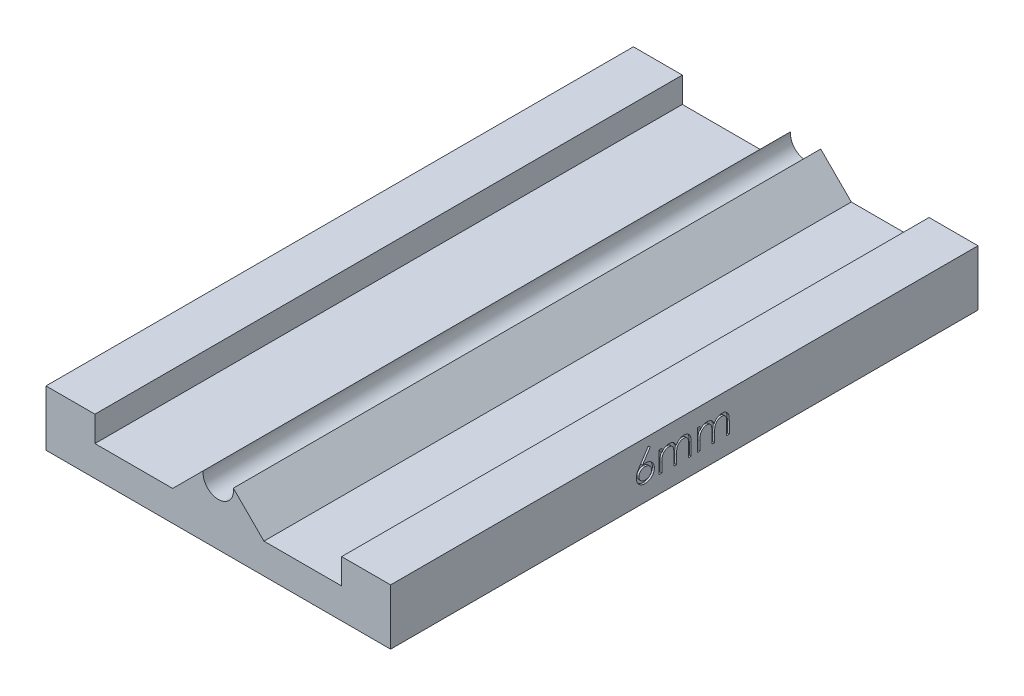
from build123d import *

# Parameters (mm, degrees)
BOSS_EXTRUDE1_DEPTH = 120
CUT_EXTRUDE1_DEPTH  = 0.4


with BuildPart() as part:
    # Sketch1 → Boss-Extrude1 (new body)
    with BuildSketch(Plane.XY):
        with BuildLine():
            ThreePointArc((3.1, 0), (-0.218115239, -3.092317212), (-3.069306931, 0.43514936))
            Line((-3.069306931, 0.43514936), (-9.320394247, -5.815937957))
            Line((-9.320394247, -5.815937957), (-25.2, -5.815937957))
            Line((-25.2, -5.815937957), (-25.2, -0.615937957))
            Line((-25.2, -0.615937957), (-35.2, -0.615937957))
            Line((-35.2, -0.615937957), (-35.2, -12))
            Line((-35.2, -12), (35.2, -12))
            Line((35.2, -12), (35.2, -0.615937957))
            Line((35.2, -0.615937957), (25.2, -0.615937957))
            Line((25.2, -0.615937957), (25.2, -5.815937957))
            Line((25.2, -5.815937957), (9.320394247, -5.815937957))
            Line((9.320394247, -5.815937957), (3.069306931, 0.43514936))
            ThreePointArc((3.069306931, 0.43514936), (3.092317212, 0.218115239), (3.1, 0))
        make_face()
    extrude(amount=BOSS_EXTRUDE1_DEPTH)

    # Sketch2 → Cut-Extrude1 (cut)
    # profile 1 of 3: a face of its own
    with BuildSketch(Plane(origin=(35.2, 0, 0), x_dir=(0, 0, -1), z_dir=(1, 0, 0))):
        with BuildLine():
            Line((-67.354397823, -2.389751919), (-66.938532439, -2.715473073))
            Line((-66.938532439, -2.715473073), (-68.523868977, -5.139751919))
            add(Edge.make_bspline(
                [(-68.523868977, -5.139751919), (-68.418319931, -5.122928158), (-68.212434582, -5.09011151), (-68.004035899, -5.084697889), (-67.902474747, -5.082059612)],
                knots=[0, 0, 0, 0, 1.025318673, 2, 2, 2, 2], degree=3))
            add(Edge.make_bspline(
                [(-67.902474747, -5.082059612), (-67.841490255, -5.083674921), (-67.721841154, -5.086844094), (-67.546033554, -5.111889088), (-67.37706088, -5.150871482), (-67.215300087, -5.207924586), (-67.060545879, -5.280781784), (-66.911913343, -5.368106642), (-66.772195572, -5.474401797), (-66.639593561, -5.593141804), (-66.519204249, -5.724656612), (-66.412616726, -5.864201766), (-66.323085082, -6.011631847), (-66.250444074, -6.166872189), (-66.194035711, -6.329683491), (-66.152914033, -6.499857444), (-66.12860616, -6.677511395), (-66.125305319, -6.798331124), (-66.123628593, -6.859703842)],
                knots=[0, 0, 0, 0, 1.044136307, 2.048553127, 3.035567123, 4.010001674, 4.980053131, 5.96154148, 6.956538004, 7.981742224, 9.006487041, 10.005615874, 10.984750588, 11.954802044, 12.935714515, 13.930994945, 14.949008866, 16, 16, 16, 16], degree=3))
            add(Edge.make_bspline(
                [(-66.123628593, -6.859703842), (-66.126068201, -6.943669049), (-66.130868773, -7.108892705), (-66.178703852, -7.349538487), (-66.253034671, -7.578794228), (-66.359281863, -7.792999665), (-66.491251662, -7.991861213), (-66.652184678, -8.168064868), (-66.836373516, -8.325213503), (-67.044636598, -8.45662485), (-67.268767394, -8.563944366), (-67.504227961, -8.641027639), (-67.74873164, -8.688485015), (-67.914682397, -8.694434619), (-67.998628593, -8.697444227)],
                knots=[0, 0, 0, 0, 1.031375318, 2.029502543, 3.004789286, 3.987476834, 4.960371455, 5.9300674, 6.912260825, 7.929083631, 8.949397511, 9.960523116, 10.96833055, 12, 12, 12, 12], degree=3))
            add(Edge.make_bspline(
                [(-67.998628593, -8.697444227), (-68.079365794, -8.694824446), (-68.239292053, -8.689635118), (-68.474548272, -8.643407796), (-68.700599159, -8.568481334), (-68.915860955, -8.465256856), (-69.11526772, -8.334871914), (-69.293665954, -8.177908007), (-69.450166139, -7.997720353), (-69.580408346, -7.7943369), (-69.683709029, -7.575782687), (-69.761177472, -7.347890419), (-69.806428175, -7.11149045), (-69.812751415, -6.951237069), (-69.815936285, -6.87052115)],
                knots=[0, 0, 0, 0, 1.012016664, 2.004627821, 2.994792927, 3.992885782, 4.990978636, 5.973936114, 6.964471063, 7.975201453, 8.993600317, 9.990122807, 10.98767138, 12, 12, 12, 12], degree=3))
            add(Edge.make_bspline(
                [(-69.815936285, -6.87052115), (-69.813910951, -6.808730436), (-69.809775605, -6.682565604), (-69.780901222, -6.491484413), (-69.734504431, -6.295968273), (-69.682544008, -6.130103941), (-69.627642962, -5.994227046), (-69.581952895, -5.884678205), (-69.525083187, -5.771944937), (-69.464443105, -5.652161561), (-69.394574187, -5.528415105), (-69.318604502, -5.398637386), (-69.234433672, -5.264892367), (-69.175427679, -5.174130889), (-69.145263208, -5.127732688)],
                knots=[0, 0, 0, 0, 1.173818275, 2.396712641, 3.66331629, 4.989737886, 5.693666774, 6.447286557, 7.243889047, 8.091586357, 8.998013824, 9.943181721, 10.948533338, 12, 12, 12, 12], degree=3))
            Line((-69.145263208, -5.127732688), (-67.354397823, -2.389751919))
        make_face()
        with BuildLine():
            add(Edge.make_bspline(
                [(-68.015455516, -5.697444227), (-68.061160759, -5.698795716), (-68.150834071, -5.701447325), (-68.282232287, -5.716422859), (-68.40625462, -5.744799772), (-68.524325818, -5.781498386), (-68.635185612, -5.831494047), (-68.740208316, -5.891403052), (-68.838185177, -5.963179298), (-68.928637922, -6.044206578), (-69.010605161, -6.133001947), (-69.081203813, -6.228088421), (-69.142098727, -6.327199555), (-69.191610583, -6.431156888), (-69.230164954, -6.539922391), (-69.258053396, -6.65299537), (-69.273574109, -6.771134186), (-69.276156221, -6.851247047), (-69.277474747, -6.892155765)],
                knots=[0, 0, 0, 0, 1.128956033, 2.215002439, 3.259141796, 4.2666399, 5.263148119, 6.255916712, 7.247353359, 8.256307737, 9.250603402, 10.226115518, 11.176314381, 12.118911324, 13.063945463, 14.021379252, 14.989639887, 16, 16, 16, 16], degree=3))
            add(Edge.make_bspline(
                [(-69.277474747, -6.892155765), (-69.276400984, -6.932698588), (-69.274295496, -7.012197028), (-69.255177233, -7.129349907), (-69.225974235, -7.24208975), (-69.182533556, -7.349835348), (-69.130716033, -7.454229036), (-69.062306906, -7.551489525), (-68.986506702, -7.647523931), (-68.895899959, -7.734955025), (-68.798659908, -7.816309238), (-68.694772132, -7.887418244), (-68.586497915, -7.948251684), (-68.472375478, -7.995927851), (-68.354023962, -8.0350552), (-68.230457298, -8.062589165), (-68.101589546, -8.078155781), (-68.014294795, -8.080741255), (-67.969782439, -8.082059612)],
                knots=[0, 0, 0, 0, 0.989467248, 1.94019797, 2.891935182, 3.827694429, 4.772920941, 5.730924762, 6.725747692, 7.756678648, 8.79901574, 9.819492441, 10.826891316, 11.826466727, 12.835195252, 13.867842842, 14.912794438, 16, 16, 16, 16], degree=3))
            add(Edge.make_bspline(
                [(-67.969782439, -8.082059612), (-67.925270156, -8.080741152), (-67.837975548, -8.078155475), (-67.709106759, -8.062590328), (-67.585543927, -8.035050932), (-67.467178484, -7.995943325), (-67.353107459, -7.94819428), (-67.244927936, -7.887796704), (-67.142022633, -7.81587193), (-67.044718748, -7.735094053), (-66.95448914, -7.647026307), (-66.876870947, -7.552346783), (-66.810556833, -7.453442962), (-66.756669655, -7.35024658), (-66.713707442, -7.242024601), (-66.684356355, -7.12936736), (-66.665277574, -7.012192458), (-66.66316666, -6.932697045), (-66.662090131, -6.892155765)],
                knots=[0, 0, 0, 0, 1.087397944, 2.132534446, 3.165364764, 4.174271784, 5.174024072, 6.181601208, 7.194203697, 8.236725232, 9.267838612, 10.269026844, 11.221737037, 12.171628256, 13.107553087, 14.05945871, 15.010357665, 16, 16, 16, 16], degree=3))
            add(Edge.make_bspline(
                [(-66.662090131, -6.892155765), (-66.663033492, -6.85119368), (-66.664885002, -6.770798428), (-66.685826611, -6.653048199), (-66.714870744, -6.539347945), (-66.758727131, -6.430411661), (-66.815704965, -6.32667148), (-66.885101619, -6.227594729), (-66.965399644, -6.132455451), (-67.058085207, -6.043978985), (-67.158980531, -5.96367887), (-67.26557675, -5.891133593), (-67.37853728, -5.832051702), (-67.495824009, -5.781328335), (-67.618849625, -5.74538149), (-67.746270341, -5.716334262), (-67.879293548, -5.701572516), (-67.969754342, -5.698829839), (-68.015455516, -5.697444227)],
                knots=[0, 0, 0, 0, 0.978753431, 1.920974676, 2.853199117, 3.782215702, 4.721507756, 5.67862441, 6.671401678, 7.694929396, 8.738190014, 9.75360867, 10.774035531, 11.783329636, 12.805060902, 13.835252836, 14.906360638, 16, 16, 16, 16], degree=3))
        make_face(mode=Mode.SUBTRACT)
    # profile 2 of 3: a face of its own
    with BuildSketch(Plane(origin=(35.2, 0, 0), x_dir=(0, 0, -1), z_dir=(1, 0, 0))):
        with BuildLine():
            Line((-65.123628593, -4.158982688), (-64.585167054, -4.158982688))
            Line((-64.585167054, -4.158982688), (-64.585167054, -4.921001919))
            add(Edge.make_bspline(
                [(-64.585167054, -4.921001919), (-64.536680283, -4.854337459), (-64.443774981, -4.726601962), (-64.291433862, -4.558275761), (-64.139246241, -4.415427496), (-64.029646158, -4.340439716), (-63.976993977, -4.304415381)],
                knots=[0, 0, 0, 0, 1.134379233, 2.173579362, 3.122582517, 4, 4, 4, 4], degree=3))
            add(Edge.make_bspline(
                [(-63.976993977, -4.304415381), (-63.905225985, -4.270120469), (-63.762943871, -4.202129817), (-63.537653771, -4.133158002), (-63.307125766, -4.090772114), (-63.151454543, -4.084975474), (-63.073147823, -4.082059612)],
                knots=[0, 0, 0, 0, 1.014936303, 2.012140481, 3.000054389, 4, 4, 4, 4], degree=3))
            add(Edge.make_bspline(
                [(-63.073147823, -4.082059612), (-63.020188401, -4.083851539), (-62.915384551, -4.087397666), (-62.760097539, -4.110472012), (-62.609482776, -4.15035688), (-62.464430155, -4.205912292), (-62.327766133, -4.273192327), (-62.202470365, -4.352134684), (-62.089971723, -4.440758241), (-61.990327063, -4.543064984), (-61.90072302, -4.661927724), (-61.81830214, -4.800552151), (-61.742144633, -4.962050998), (-61.699936675, -5.079250783), (-61.677715131, -5.140953842)],
                knots=[0, 0, 0, 0, 1.009824226, 1.998387844, 2.986035974, 3.974953746, 4.955485308, 5.885931332, 6.793869504, 7.679848016, 8.601185859, 9.625726857, 10.749998409, 12, 12, 12, 12], degree=3))
            add(Edge.make_bspline(
                [(-61.677715131, -5.140953842), (-61.654210129, -5.098569124), (-61.607955585, -5.015161949), (-61.530288779, -4.897119214), (-61.448915413, -4.786707571), (-61.363141997, -4.683839415), (-61.273271276, -4.589022734), (-61.178880304, -4.501944046), (-61.080506393, -4.422229394), (-60.943719696, -4.329103977), (-60.765755227, -4.230187666), (-60.541375601, -4.144424619), (-60.307975307, -4.091425542), (-60.149544967, -4.085202217), (-60.069542054, -4.082059612)],
                knots=[0, 0, 0, 0, 0.86119277, 1.694706429, 2.50939023, 3.298075842, 4.073795165, 4.829715201, 5.57930267, 6.321991688, 7.768977793, 9.186738141, 10.579381044, 12, 12, 12, 12], degree=3))
            add(Edge.make_bspline(
                [(-60.069542054, -4.082059612), (-59.996030975, -4.08483199), (-59.852162656, -4.090257804), (-59.642715915, -4.132863759), (-59.447387105, -4.206025439), (-59.266569261, -4.305854531), (-59.103438152, -4.431304559), (-58.961638765, -4.580565424), (-58.842032428, -4.752581349), (-58.763897617, -4.914396187), (-58.710900021, -5.057256757), (-58.678223619, -5.178981828), (-58.649355571, -5.312955919), (-58.625387722, -5.459339224), (-58.607870204, -5.618648838), (-58.594891834, -5.790624054), (-58.586107708, -5.975398531), (-58.585487013, -6.102882246), (-58.585167054, -6.168598073)],
                knots=[0, 0, 0, 0, 1.209669288, 2.367440248, 3.500751976, 4.631527125, 5.755587489, 6.87532382, 8.007944318, 9.190864318, 9.82315674, 10.514484317, 11.263564316, 12.079023757, 12.955305781, 13.901327259, 14.918167583, 16, 16, 16, 16], degree=3))
            Line((-58.585167054, -6.168598073), (-58.585167054, -8.543598073))
            Line((-58.585167054, -8.543598073), (-59.123628593, -8.543598073))
            Line((-59.123628593, -8.543598073), (-59.123628593, -6.166194227))
            add(Edge.make_bspline(
                [(-59.123628593, -6.166194227), (-59.123762106, -6.110101814), (-59.124018699, -6.002300728), (-59.128636353, -5.847582241), (-59.137336892, -5.706550771), (-59.147510558, -5.57939862), (-59.161642803, -5.465829268), (-59.179892972, -5.366070836), (-59.199226137, -5.279338588), (-59.231344979, -5.183191078), (-59.282684222, -5.07712786), (-59.360885616, -4.962744587), (-59.459405798, -4.863177501), (-59.573166067, -4.776746101), (-59.702677686, -4.706471288), (-59.845417212, -4.656283843), (-60.000498443, -4.625216051), (-60.107851795, -4.622120024), (-60.163292054, -4.62052115)],
                knots=[0, 0, 0, 0, 1.253487763, 2.409012846, 3.458416907, 4.410876679, 5.259312806, 6.014470957, 6.676830364, 7.243083969, 8.276244668, 9.299465089, 10.325150304, 11.392391894, 12.482080715, 13.603491619, 14.762376348, 16, 16, 16, 16], degree=3))
            add(Edge.make_bspline(
                [(-60.163292054, -4.62052115), (-60.23129769, -4.622948848), (-60.365702681, -4.627746903), (-60.561894943, -4.676730686), (-60.750416686, -4.750582544), (-60.925642628, -4.857609613), (-61.086833126, -4.985852523), (-61.225518117, -5.138337544), (-61.340087578, -5.31084599), (-61.417665822, -5.470526051), (-61.466676053, -5.613959384), (-61.49903648, -5.739269164), (-61.524208008, -5.881694709), (-61.54781463, -6.040278979), (-61.563222163, -6.216113574), (-61.577225087, -6.408385119), (-61.583775138, -6.617671906), (-61.584691353, -6.762746229), (-61.585167054, -6.838069227)],
                knots=[0, 0, 0, 0, 1.090531906, 2.155305635, 3.229839962, 4.33261226, 5.44038871, 6.529323825, 7.629011124, 8.757537029, 9.370236727, 10.061839251, 10.834451254, 11.692844982, 12.636905849, 13.66920014, 14.789842145, 16, 16, 16, 16], degree=3))
            Line((-61.585167054, -6.838069227), (-61.585167054, -8.543598073))
            Line((-61.585167054, -8.543598073), (-62.123628593, -8.543598073))
            Line((-62.123628593, -8.543598073), (-62.123628593, -6.314030765))
            add(Edge.make_bspline(
                [(-62.123628593, -6.314030765), (-62.12376476, -6.251127933), (-62.124026732, -6.130109207), (-62.128614705, -5.956565763), (-62.137334628, -5.798712483), (-62.147415568, -5.656732831), (-62.161918731, -5.530884839), (-62.178392609, -5.420493825), (-62.19784737, -5.325836537), (-62.230058601, -5.222013592), (-62.279283404, -5.107634867), (-62.358463281, -4.98567883), (-62.457219133, -4.87893352), (-62.57305492, -4.787804237), (-62.703350376, -4.712475984), (-62.84732192, -4.658202124), (-63.003673199, -4.626617627), (-63.111463552, -4.622591633), (-63.166897823, -4.62052115)],
                knots=[0, 0, 0, 0, 1.320475261, 2.540461679, 3.643808994, 4.639130445, 5.527981419, 6.302341397, 6.981980563, 7.553956391, 8.582137848, 9.585246428, 10.591171744, 11.620968678, 12.668337649, 13.738356861, 14.836885341, 16, 16, 16, 16], degree=3))
            add(Edge.make_bspline(
                [(-63.166897823, -4.62052115), (-63.232068472, -4.623144796), (-63.361951259, -4.628373629), (-63.552754636, -4.675438098), (-63.737015808, -4.749159369), (-63.911795291, -4.851433345), (-64.072379546, -4.978117479), (-64.212965147, -5.127114444), (-64.331152333, -5.29656993), (-64.40954973, -5.454566244), (-64.460118543, -5.594406143), (-64.493710545, -5.713293482), (-64.522578475, -5.845293908), (-64.544031084, -5.99081467), (-64.564740368, -6.148907974), (-64.574735183, -6.320361385), (-64.584457861, -6.505027821), (-64.584924858, -6.632523613), (-64.585167054, -6.69864615)],
                knots=[0, 0, 0, 0, 1.098833095, 2.189935336, 3.297829714, 4.440610912, 5.596351641, 6.740013378, 7.886572111, 9.072425424, 9.705826452, 10.395263256, 11.156850408, 11.985370555, 12.878090359, 13.847760091, 14.883794034, 16, 16, 16, 16], degree=3))
            Line((-64.585167054, -6.69864615), (-64.585167054, -8.543598073))
            Line((-64.585167054, -8.543598073), (-65.123628593, -8.543598073))
            Line((-65.123628593, -8.543598073), (-65.123628593, -4.158982688))
        make_face()
    # profile 3 of 3: a face of its own
    with BuildSketch(Plane(origin=(35.2, 0, 0), x_dir=(0, 0, -1), z_dir=(1, 0, 0))):
        with BuildLine():
            Line((-57.354397823, -4.158982688), (-56.815936285, -4.158982688))
            Line((-56.815936285, -4.158982688), (-56.815936285, -4.921001919))
            add(Edge.make_bspline(
                [(-56.815936285, -4.921001919), (-56.767449514, -4.854337459), (-56.674544212, -4.726601962), (-56.522203093, -4.558275761), (-56.370015472, -4.415427496), (-56.260415389, -4.340439716), (-56.207763208, -4.304415381)],
                knots=[0, 0, 0, 0, 1.134379233, 2.173579362, 3.122582517, 4, 4, 4, 4], degree=3))
            add(Edge.make_bspline(
                [(-56.207763208, -4.304415381), (-56.135995216, -4.270120469), (-55.993713102, -4.202129817), (-55.768423002, -4.133158002), (-55.537894997, -4.090772114), (-55.382223773, -4.084975474), (-55.303917054, -4.082059612)],
                knots=[0, 0, 0, 0, 1.014936303, 2.012140481, 3.000054389, 4, 4, 4, 4], degree=3))
            add(Edge.make_bspline(
                [(-55.303917054, -4.082059612), (-55.250957632, -4.083851539), (-55.146153782, -4.087397666), (-54.99086677, -4.110472012), (-54.840252007, -4.15035688), (-54.695199385, -4.205912292), (-54.558535364, -4.273192327), (-54.433239596, -4.352134684), (-54.320740954, -4.440758241), (-54.221096294, -4.543064984), (-54.131492251, -4.661927724), (-54.049071371, -4.800552151), (-53.972913864, -4.962050998), (-53.930705906, -5.079250783), (-53.908484362, -5.140953842)],
                knots=[0, 0, 0, 0, 1.009824226, 1.998387844, 2.986035974, 3.974953746, 4.955485308, 5.885931332, 6.793869504, 7.679848016, 8.601185859, 9.625726857, 10.749998409, 12, 12, 12, 12], degree=3))
            add(Edge.make_bspline(
                [(-53.908484362, -5.140953842), (-53.88497936, -5.098569124), (-53.838724816, -5.015161949), (-53.76105801, -4.897119214), (-53.679684644, -4.786707571), (-53.593911228, -4.683839415), (-53.504040507, -4.589022734), (-53.409649535, -4.501944046), (-53.311275624, -4.422229394), (-53.174488927, -4.329103977), (-52.996524457, -4.230187666), (-52.772144832, -4.144424619), (-52.538744538, -4.091425542), (-52.380314198, -4.085202217), (-52.300311285, -4.082059612)],
                knots=[0, 0, 0, 0, 0.86119277, 1.694706429, 2.50939023, 3.298075842, 4.073795165, 4.829715201, 5.57930267, 6.321991688, 7.768977793, 9.186738141, 10.579381044, 12, 12, 12, 12], degree=3))
            add(Edge.make_bspline(
                [(-52.300311285, -4.082059612), (-52.226800206, -4.08483199), (-52.082931887, -4.090257804), (-51.873485145, -4.132863759), (-51.678156336, -4.206025439), (-51.497338491, -4.305854531), (-51.334207383, -4.431304559), (-51.192407996, -4.580565424), (-51.072801658, -4.752581349), (-50.994666848, -4.914396187), (-50.941669252, -5.057256757), (-50.90899285, -5.178981828), (-50.880124801, -5.312955919), (-50.856156952, -5.459339224), (-50.838639434, -5.618648838), (-50.825661065, -5.790624054), (-50.816876939, -5.975398531), (-50.816256244, -6.102882246), (-50.815936285, -6.168598073)],
                knots=[0, 0, 0, 0, 1.209669288, 2.367440248, 3.500751976, 4.631527125, 5.755587489, 6.87532382, 8.007944318, 9.190864318, 9.82315674, 10.514484317, 11.263564316, 12.079023757, 12.955305781, 13.901327259, 14.918167583, 16, 16, 16, 16], degree=3))
            Line((-50.815936285, -6.168598073), (-50.815936285, -8.543598073))
            Line((-50.815936285, -8.543598073), (-51.354397823, -8.543598073))
            Line((-51.354397823, -8.543598073), (-51.354397823, -6.166194227))
            add(Edge.make_bspline(
                [(-51.354397823, -6.166194227), (-51.354531337, -6.110101814), (-51.35478793, -6.002300728), (-51.359405584, -5.847582241), (-51.368106123, -5.706550771), (-51.378279789, -5.57939862), (-51.392412034, -5.465829268), (-51.410662202, -5.366070836), (-51.429995368, -5.279338588), (-51.46211421, -5.183191078), (-51.513453453, -5.07712786), (-51.591654847, -4.962744587), (-51.690175029, -4.863177501), (-51.803935298, -4.776746101), (-51.933446917, -4.706471288), (-52.076186442, -4.656283843), (-52.231267674, -4.625216051), (-52.338621025, -4.622120024), (-52.394061285, -4.62052115)],
                knots=[0, 0, 0, 0, 1.253487763, 2.409012846, 3.458416907, 4.410876679, 5.259312806, 6.014470957, 6.676830364, 7.243083969, 8.276244668, 9.299465089, 10.325150304, 11.392391894, 12.482080715, 13.603491619, 14.762376348, 16, 16, 16, 16], degree=3))
            add(Edge.make_bspline(
                [(-52.394061285, -4.62052115), (-52.462066921, -4.622948848), (-52.596471912, -4.627746903), (-52.792664174, -4.676730686), (-52.981185917, -4.750582544), (-53.156411859, -4.857609613), (-53.317602357, -4.985852523), (-53.456287347, -5.138337544), (-53.570856809, -5.31084599), (-53.648435053, -5.470526051), (-53.697445284, -5.613959384), (-53.729805711, -5.739269164), (-53.754977239, -5.881694709), (-53.77858386, -6.040278979), (-53.793991394, -6.216113574), (-53.807994318, -6.408385119), (-53.814544369, -6.617671906), (-53.815460584, -6.762746229), (-53.815936285, -6.838069227)],
                knots=[0, 0, 0, 0, 1.090531906, 2.155305635, 3.229839962, 4.33261226, 5.44038871, 6.529323825, 7.629011124, 8.757537029, 9.370236727, 10.061839251, 10.834451254, 11.692844982, 12.636905849, 13.66920014, 14.789842145, 16, 16, 16, 16], degree=3))
            Line((-53.815936285, -6.838069227), (-53.815936285, -8.543598073))
            Line((-53.815936285, -8.543598073), (-54.354397823, -8.543598073))
            Line((-54.354397823, -8.543598073), (-54.354397823, -6.314030765))
            add(Edge.make_bspline(
                [(-54.354397823, -6.314030765), (-54.354533991, -6.251127933), (-54.354795963, -6.130109207), (-54.359383936, -5.956565763), (-54.368103859, -5.798712483), (-54.378184799, -5.656732831), (-54.392687962, -5.530884839), (-54.40916184, -5.420493825), (-54.428616601, -5.325836537), (-54.460827832, -5.222013592), (-54.510052634, -5.107634867), (-54.589232512, -4.98567883), (-54.687988364, -4.87893352), (-54.803824151, -4.787804237), (-54.934119606, -4.712475984), (-55.078091151, -4.658202124), (-55.23444243, -4.626617627), (-55.342232783, -4.622591633), (-55.397667054, -4.62052115)],
                knots=[0, 0, 0, 0, 1.320475261, 2.540461679, 3.643808994, 4.639130445, 5.527981419, 6.302341397, 6.981980563, 7.553956391, 8.582137848, 9.585246428, 10.591171744, 11.620968678, 12.668337649, 13.738356861, 14.836885341, 16, 16, 16, 16], degree=3))
            add(Edge.make_bspline(
                [(-55.397667054, -4.62052115), (-55.462837702, -4.623144796), (-55.59272049, -4.628373629), (-55.783523867, -4.675438098), (-55.967785038, -4.749159369), (-56.142564522, -4.851433345), (-56.303148776, -4.978117479), (-56.443734377, -5.127114444), (-56.561921564, -5.29656993), (-56.640318961, -5.454566244), (-56.690887774, -5.594406143), (-56.724479776, -5.713293482), (-56.753347706, -5.845293908), (-56.774800315, -5.99081467), (-56.795509599, -6.148907974), (-56.805504414, -6.320361385), (-56.815227092, -6.505027821), (-56.815694089, -6.632523613), (-56.815936285, -6.69864615)],
                knots=[0, 0, 0, 0, 1.098833095, 2.189935336, 3.297829714, 4.440610912, 5.596351641, 6.740013378, 7.886572111, 9.072425424, 9.705826452, 10.395263256, 11.156850408, 11.985370555, 12.878090359, 13.847760091, 14.883794034, 16, 16, 16, 16], degree=3))
            Line((-56.815936285, -6.69864615), (-56.815936285, -8.543598073))
            Line((-56.815936285, -8.543598073), (-57.354397823, -8.543598073))
            Line((-57.354397823, -8.543598073), (-57.354397823, -4.158982688))
        make_face()
    extrude(amount=-CUT_EXTRUDE1_DEPTH, mode=Mode.SUBTRACT)


solid = part.part
